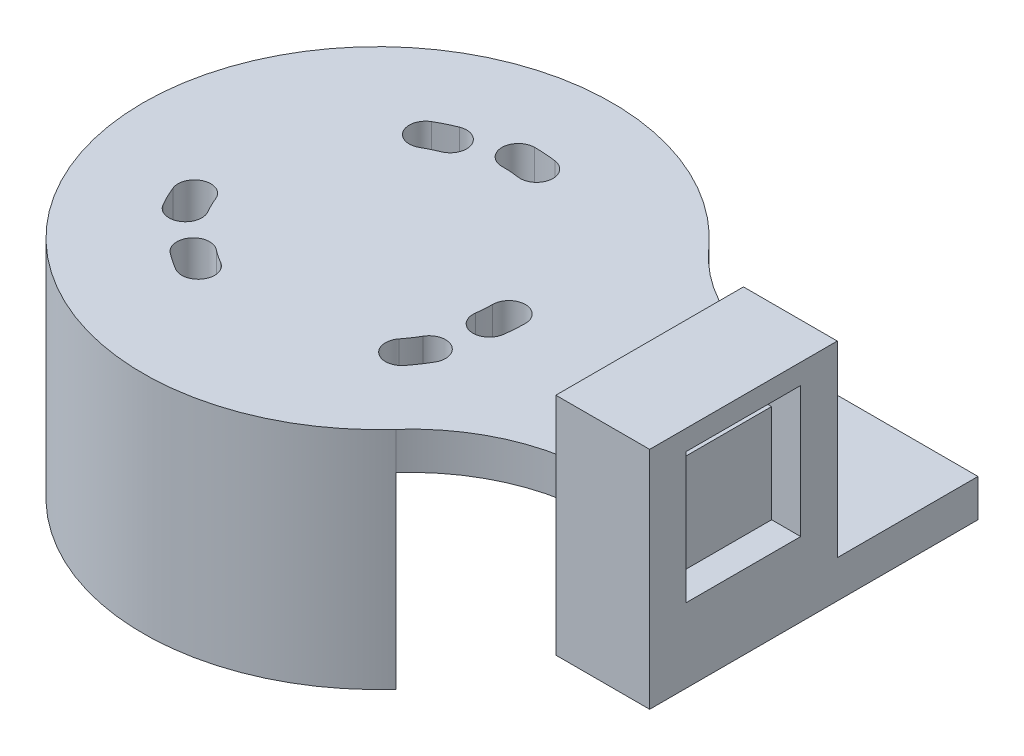
from build123d import *

# Parameters (mm, degrees)
BOSS_EXTRUDE1_DEPTH = 4
FILLET1_R           = 20
SKETCH1_R           = 2.75
CUT_EXTRUDE3_DEPTH  = 131.855321132
BOSS_EXTRUDE2_START = 20
BOSS_EXTRUDE2_DEPTH = 20
SKETCH7_W           = 10
SKETCH7_H           = 20
BOSS_EXTRUDE3_DEPTH = 20
SKETCH8_W           = 12.2
SKETCH8_H           = 12.2
CUT_EXTRUDE4_DEPTH  = 3.1
CUT_EXTRUDE5_REACH  = 88.267
SKETCH8_3_W         = 12.2
SKETCH8_3_H         = 3.5


with BuildPart() as part:
    # Sketch3 → Boss-Extrude1 (new body)
    with BuildSketch(Plane(origin=(0, 0, 0), x_dir=(1, 0, 0), z_dir=(0, 1, 0))):
        with BuildLine():
            Line((22.912878475, 10), (44, 10))
            Line((44, 10), (54, 10))
            Line((54, 10), (54, -25))
            Line((54, -25), (44, -25))
            Line((44, -25), (44, -10))
            Line((44, -10), (22.912878475, -10))
            ThreePointArc((22.912878475, -10), (-25, 0), (22.912878475, 10))
        make_face()
    extrude(amount=BOSS_EXTRUDE1_DEPTH)

    # Fillet1
    fillet1_edges = [part.edges().sort_by_distance(p)[0] for p in [
        (22.912878475, 2, 10),
        (22.912878475, 2, -10),
    ]]
    fillet(fillet1_edges, radius=FILLET1_R)

    # Sketch1 → Cut-Extrude3 (cut, through all)
    with BuildSketch(Plane(origin=(103.38268991, 0, 0), x_dir=(1, 0, 0), z_dir=(0, 1, 0))):
        with Locations((-66.469811435, 0)):
            Circle(SKETCH1_R)
        with BuildLine():
            ThreePointArc((-91.90785331, -6.625), (-92.397942073, -7.409305971), (-92.941547424, -8.157514548))
            ThreePointArc((-92.941547424, -8.157514548), (-92.639936187, -10.613940949), (-90.183509787, -10.312329712))
            ThreePointArc((-90.183509787, -10.312329712), (-89.496310569, -9.366481133), (-88.876764396, -8.375))
            ThreePointArc((-88.876764396, -8.375), (-89.517308853, -5.984455543), (-91.90785331, -6.625))
        make_face()
        with BuildLine():
            ThreePointArc((-91.13268991, 0), (-91.162530294, -0.854516803), (-91.251906068, -1.704870487))
            ThreePointArc((-91.251906068, -1.704870487), (-89.762489874, -3.681392534), (-87.785967827, -2.19197634))
            ThreePointArc((-87.785967827, -2.19197634), (-87.671056118, -1.098664461), (-87.63268991, 0))
            ThreePointArc((-87.63268991, 0), (-89.38268991, 1.75), (-91.13268991, 0))
        make_face()
        with BuildLine():
            ThreePointArc((-114.85752651, -6.625), (-115.498070966, -9.015544457), (-117.888615423, -8.375))
            ThreePointArc((-117.888615423, -8.375), (-118.437490185, -7.342716709), (-118.913019474, -6.27466044))
            ThreePointArc((-118.913019474, -6.27466044), (-117.946009267, -3.996527156), (-115.667875983, -4.963537363))
            ThreePointArc((-115.667875983, -4.963537363), (-115.291711023, -5.808417695), (-114.85752651, -6.625))
        make_face()
        with BuildLine():
            ThreePointArc((-111.25768991, -13.63990011), (-108.867145453, -12.999355653), (-109.50768991, -10.608811196))
            ThreePointArc((-109.50768991, -10.608811196), (-110.232802977, -10.155710264), (-110.924542982, -9.653131732))
            ThreePointArc((-110.924542982, -9.653131732), (-113.380969383, -9.954742969), (-113.079358146, -12.411169369))
            ThreePointArc((-113.079358146, -12.411169369), (-112.189978139, -13.057341768), (-111.25768991, -13.63990011))
        make_face()
        with BuildLine():
            ThreePointArc((-103.38268991, 13.25), (-105.13268991, 15), (-103.38268991, 16.75))
            ThreePointArc((-103.38268991, 16.75), (-102.214268974, 16.709197842), (-101.051540469, 16.586990151))
            ThreePointArc((-101.051540469, 16.586990151), (-99.562124275, 14.610468104), (-101.538646322, 13.121051911))
            ThreePointArc((-101.538646322, 13.121051911), (-102.458416633, 13.217723666), (-103.38268991, 13.25))
        make_face()
        with BuildLine():
            ThreePointArc((-111.25768991, 13.63990011), (-111.898234366, 11.249355653), (-109.50768991, 10.608811196))
            ThreePointArc((-109.50768991, 10.608811196), (-108.752736458, 11.010227067), (-107.971620679, 11.358002218))
            ThreePointArc((-107.971620679, 11.358002218), (-107.004610472, 13.636135502), (-109.282743756, 14.603145709))
            ThreePointArc((-109.282743756, 14.603145709), (-110.287035472, 14.156006229), (-111.25768991, 13.63990011))
        make_face()
    extrude(amount=CUT_EXTRUDE3_DEPTH, mode=Mode.SUBTRACT)

    # Sketch4 → Boss-Extrude2 (add)
    with BuildSketch(Plane.XZ.offset(BOSS_EXTRUDE2_START)):
        with BuildLine():
            Line((18.633899812, 16.666666667), (17.452315988, 15.609825965))
            ThreePointArc((17.452315988, 15.609825965), (16.092851842, 15.100708662), (14.747154343, 15.645173018))
            ThreePointArc((14.747154343, 15.645173018), (-21.5, 0), (14.747154343, -15.645173018))
            ThreePointArc((14.747154343, -15.645173018), (16.092851842, -15.100708662), (17.452315988, -15.609825965))
            Line((17.452315988, -15.609825965), (18.633899812, -16.666666667))
            ThreePointArc((18.633899812, -16.666666667), (-25, 0), (18.633899812, 16.666666667))
        make_face()
    extrude(amount=-BOSS_EXTRUDE2_DEPTH)

    # Sketch7 → Boss-Extrude3 (add)
    with BuildSketch(Plane(origin=(0, 4, 0), x_dir=(1, 0, 0), z_dir=(0, 1, 0))):
        with Locations((49, -15)):
            Rectangle(SKETCH7_W, SKETCH7_H)
    extrude(amount=BOSS_EXTRUDE3_DEPTH)

    # Sketch8 → Cut-Extrude4 (cut)
    with BuildSketch(Plane(origin=(54, 0, 0), x_dir=(0, 0, -1), z_dir=(1, 0, 0))):
        with Locations((-15, 14)):
            Rectangle(SKETCH8_W, SKETCH8_H)
    extrude(amount=-CUT_EXTRUDE4_DEPTH, mode=Mode.SUBTRACT)

    # Sketch8<3> → Cut-Extrude5 (cut, up to next)
    with BuildSketch(Plane(origin=(54, 0, 0), x_dir=(0, 0, -1), z_dir=(1, 0, 0)), mode=Mode.PRIVATE) as cut_extrude5_sk1:
        with Locations((-15, 20.1)):
            Rectangle(SKETCH8_3_W, SKETCH8_3_H)
    cut_extrude5_tool1 = extrude(cut_extrude5_sk1.sketch, amount=-CUT_EXTRUDE5_REACH, mode=Mode.PRIVATE) & part.part
    add(cut_extrude5_tool1.solids().sort_by_distance((54, 20.1, 15))[0], mode=Mode.SUBTRACT)


solid = part.part
